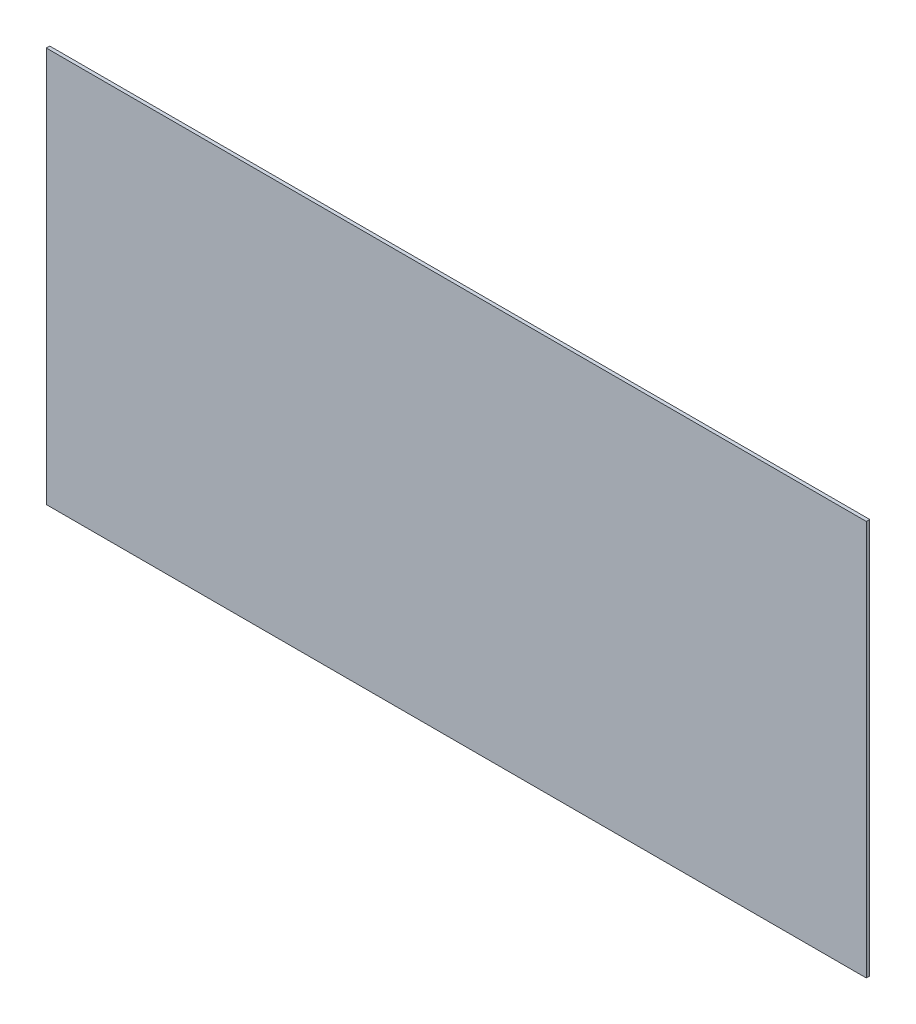
from build123d import *

# Parameters (mm, degrees)
SKETCH1_W           = 477
SKETCH1_H           = 230
BOSS_EXTRUDE1_DEPTH = 2


with BuildPart() as part:
    # Sketch1 → Boss-Extrude1 (new body)
    with BuildSketch(Plane.XY):
        Rectangle(SKETCH1_W, SKETCH1_H)
    extrude(amount=BOSS_EXTRUDE1_DEPTH)


solid = part.part
